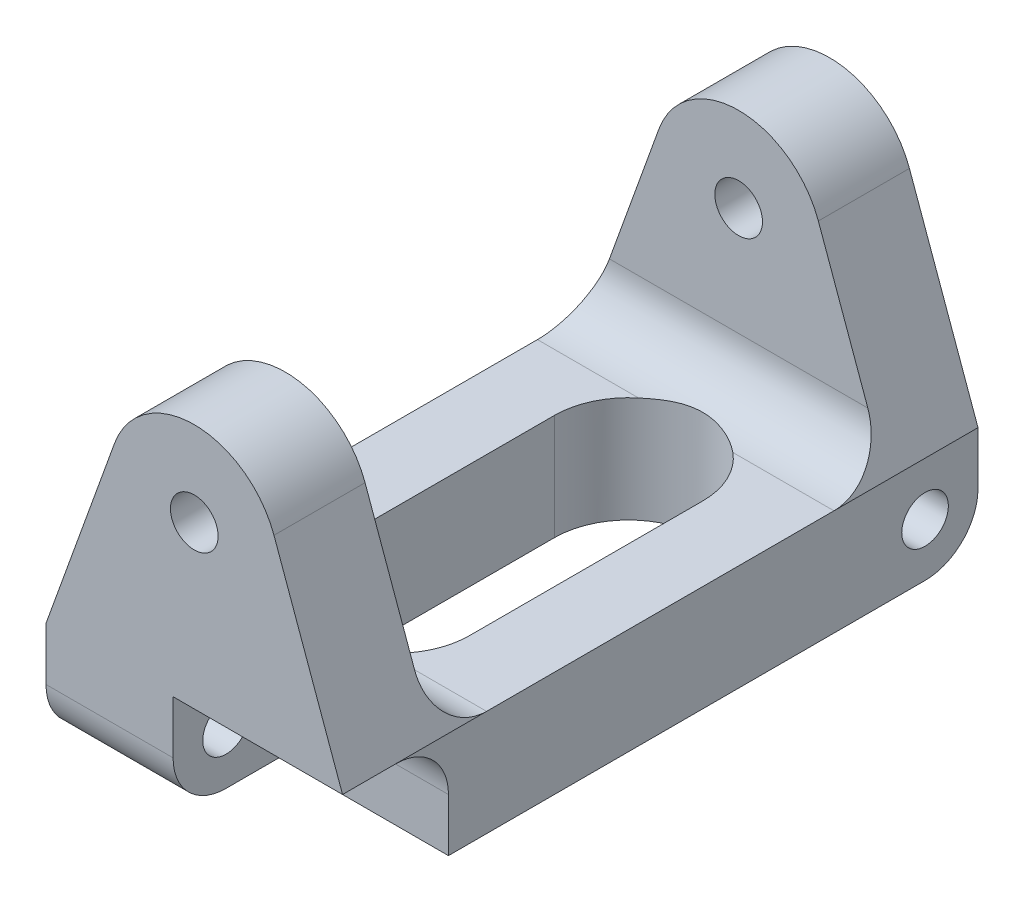
from build123d import *

# Parameters (mm, degrees)
SKETCH1_W                      = 14
SKETCH1_H                      = 15
BOSS_EXTRUDE1_DEPTH            = 5
SKETCH3_R                      = 1.1
CUT_EXTRUDE1_DEPTH             = 14
BOSS_EXTRUDE2_DEPTH            = 4.3
SKETCH5_R                      = 1.125
CUT_EXTRUDE2_DEPTH             = 4.3
FILLET1_R                      = 2.5
CUT_EXTRUDE3_REACH             = 22.227
CUT_EXTRUDE3_DIRECTION_2_REACH = 22.227
CUT_EXTRUDE4_START             = -6
CUT_EXTRUDE4_DEPTH             = 8


with BuildPart() as part:
    # Sketch1 → Boss-Extrude1 (new body)
    with BuildSketch(Plane(origin=(0, 0, 0), x_dir=(1, 0, 0), z_dir=(0, 1, 0))):
        with Locations((0, 7.5)):
            Rectangle(SKETCH1_W, SKETCH1_H)
    extrude(amount=-BOSS_EXTRUDE1_DEPTH)

    # Sketch3 → Cut-Extrude1 (cut)
    with BuildSketch(Plane.ZY.offset(7)):
        with Locations((-12.5, -2.5)):
            Circle(SKETCH3_R)
    extrude(amount=-CUT_EXTRUDE1_DEPTH, mode=Mode.SUBTRACT)

    # Sketch4 → Boss-Extrude2 (add)
    with BuildSketch(Plane(origin=(0, 0, -15), x_dir=(-1, 0, 0), z_dir=(0, 0, -1))):
        with BuildLine():
            Line((-7, 0), (-3.763056055, 8.981248181))
            ThreePointArc((-3.763056055, 8.981248181), (0, 11.625), (3.763056055, 8.981248181))
            Line((3.763056055, 8.981248181), (7, 0))
            Line((7, 0), (-7, 0))
        make_face()
    extrude(amount=-BOSS_EXTRUDE2_DEPTH)

    # Sketch5 → Cut-Extrude2 (cut)
    with BuildSketch(Plane(origin=(0, 0, -15), x_dir=(-1, 0, 0), z_dir=(0, 0, -1))):
        with Locations((0, 7.625)):
            Circle(SKETCH5_R)
    extrude(amount=-CUT_EXTRUDE2_DEPTH, mode=Mode.SUBTRACT)

    # Fillet1
    fillet1_edges = [part.edges().sort_by_distance(p)[0] for p in [
        (0, -5, -15),
        (0, 0, -10.7),
    ]]
    fillet(fillet1_edges, radius=FILLET1_R)

    # Sketch6 → Cut-Extrude3 (cut, up to next)
    with BuildSketch(Plane(origin=(0, 0, 0), x_dir=(1, 0, 0), z_dir=(0, 1, 0)), mode=Mode.PRIVATE) as cut_extrude3_sk1:
        with BuildLine():
            Line((-3.5, -5.5), (-3.5, 5.5))
            ThreePointArc((-3.5, 5.5), (0, 9), (3.5, 5.5))
            Line((3.5, 5.5), (3.5, -5.5))
            ThreePointArc((3.5, -5.5), (0, -9), (-3.5, -5.5))
        make_face()
    cut_extrude3_tool1 = extrude(cut_extrude3_sk1.sketch, amount=-CUT_EXTRUDE3_REACH, mode=Mode.PRIVATE) & part.part
    add(cut_extrude3_tool1.solids().sort_by_distance((0, 0, 0))[0], mode=Mode.SUBTRACT)

    # Sketch6 → Cut-Extrude3 direction 2 (cut, up to next)
    with BuildSketch(Plane(origin=(0, 0, 0), x_dir=(1, 0, 0), z_dir=(0, 1, 0)), mode=Mode.PRIVATE) as cut_extrude3_direction_2_sk1:
        with BuildLine():
            Line((-3.5, -5.5), (-3.5, 5.5))
            ThreePointArc((-3.5, 5.5), (0, 9), (3.5, 5.5))
            Line((3.5, 5.5), (3.5, -5.5))
            ThreePointArc((3.5, -5.5), (0, -9), (-3.5, -5.5))
        make_face()
    cut_extrude3_direction_2_tool1 = extrude(cut_extrude3_direction_2_sk1.sketch, amount=CUT_EXTRUDE3_DIRECTION_2_REACH, mode=Mode.PRIVATE) & part.part
    add(cut_extrude3_direction_2_tool1.solids().sort_by_distance((0, 0, 0))[0], mode=Mode.SUBTRACT)

    # Mirror1: part across plane


with BuildPart() as part_1:
    add(part.part)
    add(part.part.mirror(Plane.XY))

    # Sketch10 → Cut-Extrude4 (cut)
    with BuildSketch(Plane.ZY.offset(7).offset(CUT_EXTRUDE4_START)):
        with BuildLine():
            ThreePointArc((15, -2.5), (14.267766953, -0.732233047), (12.5, 0))
            ThreePointArc((12.5, 0), (10.732233047, -0.732233047), (10, -2.5))
            ThreePointArc((10, -2.5), (10.732233047, -4.267766953), (12.5, -5))
            ThreePointArc((12.5, -5), (14.267766953, -4.267766953), (15, -2.5))
        make_face()
        with BuildLine():
            Line((15, 0), (12.5, 0))
            ThreePointArc((12.5, 0), (14.267766953, -0.732233047), (15, -2.5))
            Line((15, -2.5), (15, 0))
        make_face()
        with BuildLine():
            ThreePointArc((12.5, -5), (10.732233047, -4.267766953), (10, -2.5))
            Line((10, -2.5), (10, -5))
            Line((10, -5), (12.5, -5))
        make_face()
    extrude(amount=-CUT_EXTRUDE4_DEPTH, mode=Mode.SUBTRACT)


solid = part_1.part
